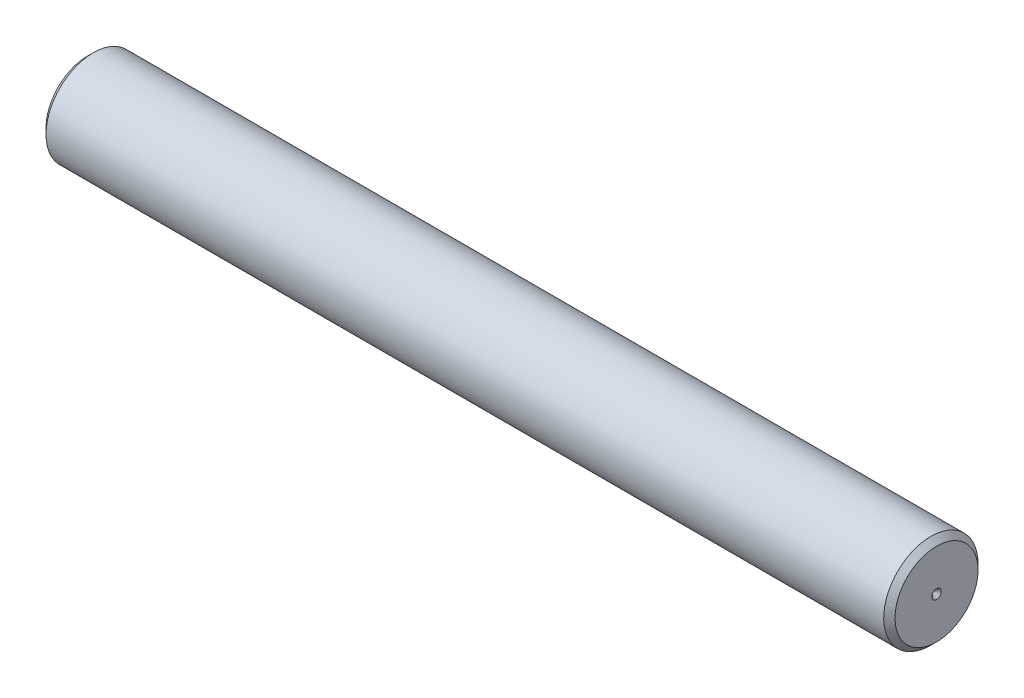
from build123d import *

# Parameters (mm, degrees)
SKETCH1_W     = 45
SKETCH1_H     = 2.5
CHAMFER1_SIZE = 0.3


with BuildPart() as part:
    # Sketch1 → Revolve1 (revolve)
    with BuildSketch(Plane.XY):
        with Locations((-22.5, 1.25)):
            Rectangle(SKETCH1_W, SKETCH1_H)
    revolve(axis=Axis((0, 0, 0), (-1, 0, 0)))

    # Chamfer1
    chamfer1_edges = [part.edges().sort_by_distance(p)[0] for p in [
        (-45, -2.5, 0),
        (0, -2.5, 0),
    ]]
    chamfer(chamfer1_edges, length=CHAMFER1_SIZE)

    # Sketch2 → Cut-Revolve1 (revolve, cut)
    with BuildSketch(Plane.XY, mode=Mode.PRIVATE) as cut_revolve1_sk:
        Polygon((-45, 0), (-44.75, 0), (-45, 0.25), align=None)
        Polygon((0, 0), (0, 0.25), (-0.25, 0), align=None)
    revolve(cut_revolve1_sk.sketch.rotate(Axis((0, 0, 0), (-1, 0, 0)), 180), axis=Axis((0, 0, 0), (-1, 0, 0)), mode=Mode.SUBTRACT)


solid = part.part
